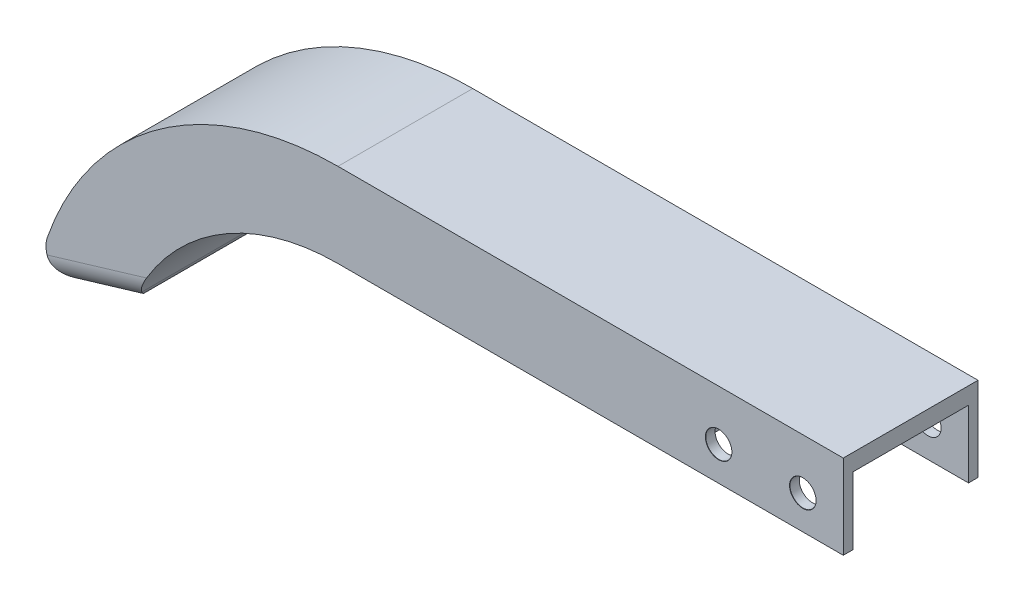
from build123d import *

# Parameters (mm, degrees)
SKETCH1_W                        = 60
SKETCH1_H                        = 16
BOSS_EXTRUDE1_DEPTH              = 10
SKETCH3_W                        = 20.254
SKETCH3_H                        = 13.746
CUT_EXTRUDE1_DEPTH               = 8
M2_5_CLEARANCE_HOLE1_D           = 3.1
M2_5_CLEARANCE_HOLE1_CSINK_D     = 3.15
M2_5_CLEARANCE_HOLE1_CSINK_ANGLE = 90
BOSS_EXTRUDE4_DEPTH              = 35
CUT_EXTRUDE8_DEPTH               = 107.825342634
CUT_EXTRUDE8_DEPTH_BACK          = 107.825342634
SKETCH14_OUTSIDE_W               = 163.346
SKETCH14_OUTSIDE_H               = 64.796
FILLET6_R                        = 3


with BuildPart() as part:
    # Sketch1 → Boss-Extrude1 (new body)
    with BuildSketch(Plane(origin=(0, 0, 0), x_dir=(1, 0, 0), z_dir=(0, 1, 0))):
        Rectangle(SKETCH1_W, SKETCH1_H)
    extrude(amount=BOSS_EXTRUDE1_DEPTH)

    # Sketch3 → Cut-Extrude1 (cut)
    with BuildSketch(Plane(origin=(0, 0, 0), x_dir=(1, 0, 0), z_dir=(0, 1, 0))):
        with Locations((19.873, 0)):
            Rectangle(SKETCH3_W, SKETCH3_H)
    extrude(amount=CUT_EXTRUDE1_DEPTH, mode=Mode.SUBTRACT)

    # M2.5 Clearance Hole1 (through all)
    with Locations(Plane.XY.offset(8)):
        with Locations((15.2, 4), (25.2, 4)):
            CounterSinkHole(M2_5_CLEARANCE_HOLE1_D / 2, M2_5_CLEARANCE_HOLE1_CSINK_D / 2, counter_sink_angle=M2_5_CLEARANCE_HOLE1_CSINK_ANGLE)

    # Sketch12 → Boss-Extrude4 (add)
    with BuildSketch(Plane(origin=(0, 10, 0), x_dir=(1, 0, 0), z_dir=(0, 1, 0))):
        Polygon((-30, 8), (-103.550247845, 7.999936172), (-103.550247845, -3.1914e-05), (-103.550247845, -8), (-30, -8), align=None)
    extrude(amount=-BOSS_EXTRUDE4_DEPTH)

    # Sketch14 outside → Cut-Extrude8 (cut, two sides: drawn at the far end of the back side and taken through both)
    with BuildSketch(Plane.XY.offset(-CUT_EXTRUDE8_DEPTH_BACK)):
        with Locations((-36.775, -7.5)):
            Rectangle(SKETCH14_OUTSIDE_W, SKETCH14_OUTSIDE_H)
        with BuildLine():
            Line((30, 0), (-30, 0))
            ThreePointArc((-30, 0), (-44.809706125, -4.518239103), (-54.575111815, -16.534009232))
            Line((-54.575111815, -16.534009232), (-65.929573082, -19.931975488))
            ThreePointArc((-65.929573082, -19.931975488), (-53.381923459, 1.536604003), (-30, 10))
            Line((-30, 10), (30, 10))
            Line((30, 10), (30, 0))
        make_face(mode=Mode.SUBTRACT)
    extrude(amount=CUT_EXTRUDE8_DEPTH + CUT_EXTRUDE8_DEPTH_BACK, mode=Mode.SUBTRACT)

    # Fillet6
    fillet6_edges = [part.edges().sort_by_distance(p)[0] for p in [
        (-54.575111815, -16.534009232, 1.0663e-05),
        (-60.252342448, -18.23299236, -7.999973747),
        (-65.929573082, -19.931975488, 1.559e-05),
        (-60.252342448, -18.23299236, 8),
    ]]
    fillet(fillet6_edges, radius=FILLET6_R)


solid = part.part
